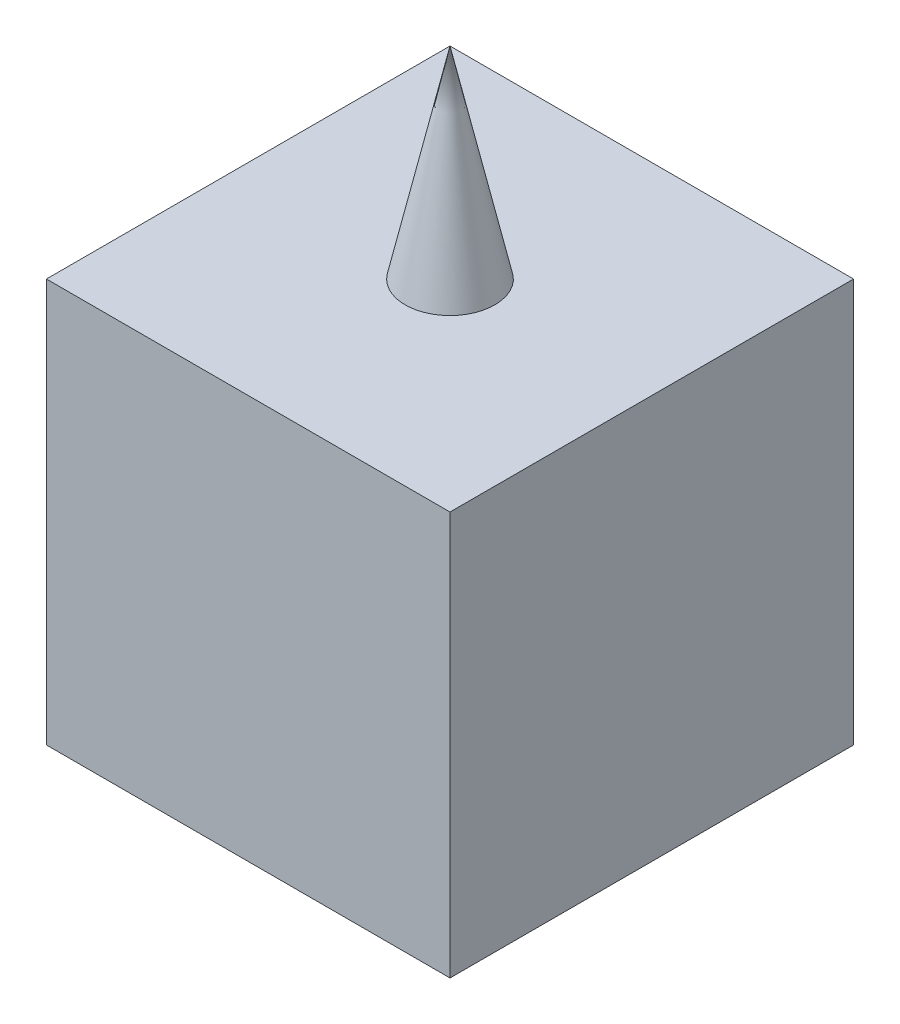
from build123d import *

# Parameters (mm, degrees)
SKETCH1_W  = 152.4
SKETCH1_H  = 152.4
CUBE_DEPTH = 152.4
SKETCH2_R  = 50.8


with BuildPart() as part:
    # Sketch1 → Cube (new body)
    with BuildSketch(Plane.XY):
        with Locations((76.2, 76.2)):
            Rectangle(SKETCH1_W, SKETCH1_H)
    extrude(amount=CUBE_DEPTH)


with BuildPart() as body_2:
    # Sketch2 → Cone section 0
    with BuildSketch(Plane.XZ, mode=Mode.PRIVATE) as cone_s0:
        with Locations((76.2, 76.2)):
            Circle(SKETCH2_R)
    loft([cone_s0.sketch, Vertex(76.2, 228.6, 76.2)])


solid = Compound([part.part, body_2.part])
